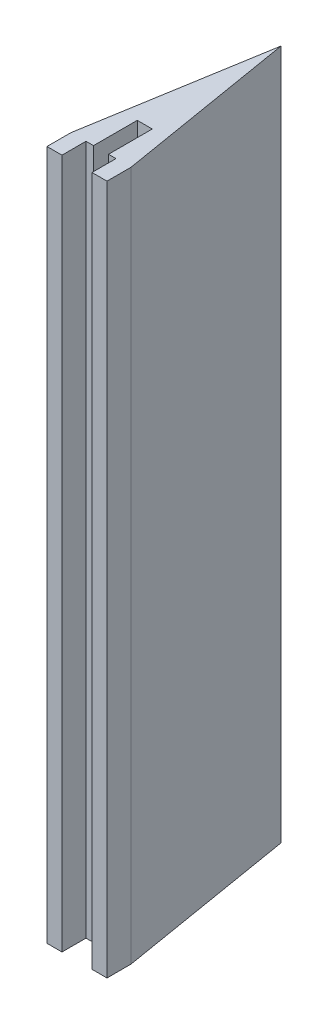
from build123d import *

# Parameters (mm, degrees)
BOSS_EXTRUDE1_DEPTH = 146.05


with BuildPart() as part:
    # Sketch1 → Boss-Extrude1 (new body)
    with BuildSketch(Plane(origin=(0, 0, 0), x_dir=(1, 0, 0), z_dir=(0, 1, 0))):
        Polygon((0, 38.1), (-6.35, 0), (-6.35, -5.08), (-3.175, -5.08), (-3.175, 0), (-1.5875, 0), (-1.5875, 9.262228966), (1.5875, 9.262228966), (1.5875, 0), (3.175, 0), (3.175, -5.08), (6.35, -5.08), (6.35, 0), align=None)
    extrude(amount=BOSS_EXTRUDE1_DEPTH)


solid = part.part
